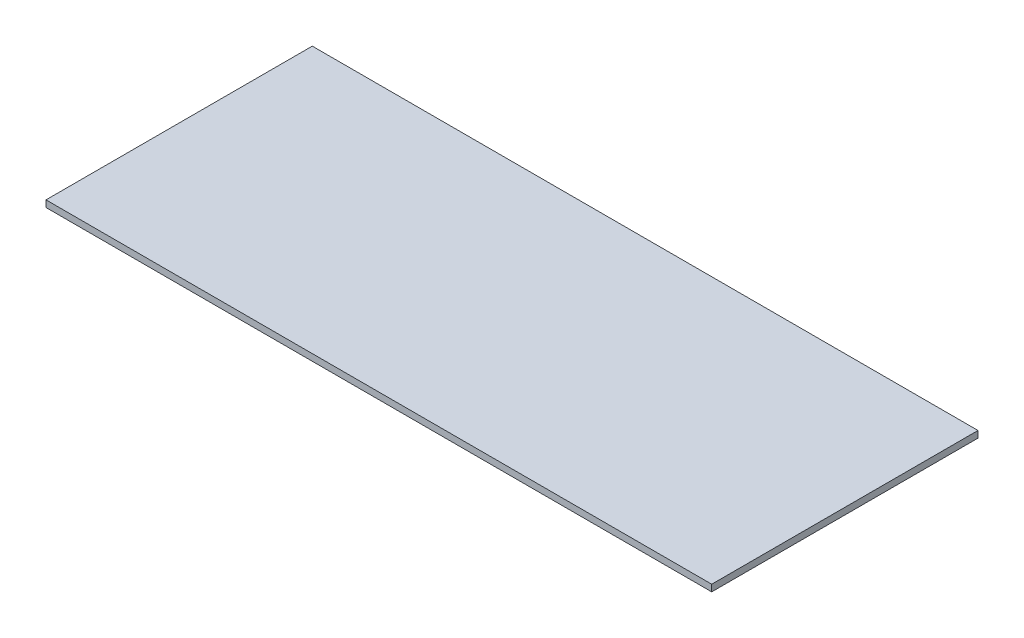
from build123d import *

# Parameters (mm, degrees)
SKETCH1_W           = 5000
SKETCH1_H           = 2000
BOSS_EXTRUDE1_DEPTH = 50


with BuildPart() as part:
    # Sketch1 → Boss-Extrude1 (new body)
    with BuildSketch(Plane(origin=(0, 0, 0), x_dir=(1, 0, 0), z_dir=(0, 1, 0))):
        Rectangle(SKETCH1_W, SKETCH1_H)
    extrude(amount=BOSS_EXTRUDE1_DEPTH)


solid = part.part
